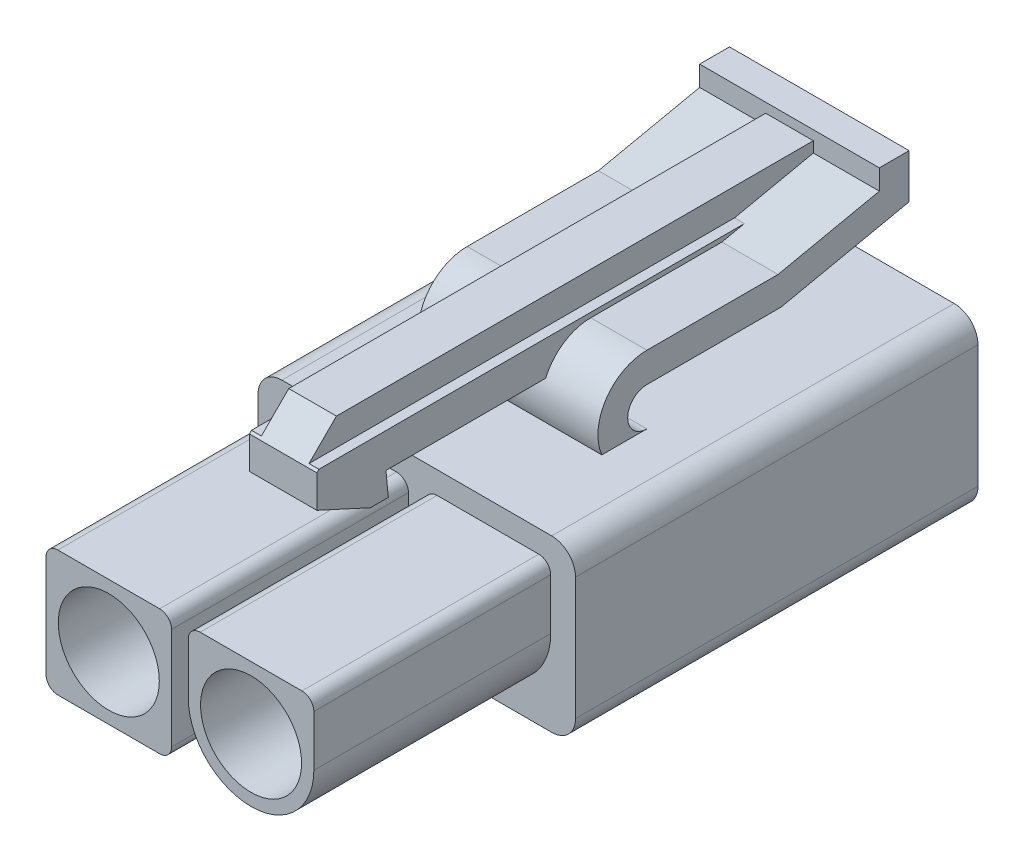
from build123d import *

# Parameters (mm, degrees)
SKETCH1_W               = 13.32
SKETCH1_H               = 7.14
BOSS_EXTRUDE1_DEPTH     = 16.89
SKETCH2_W               = 5.27
SKETCH2_H               = 5.27
BOSS_EXTRUDE2_DEPTH     = 9.94
CUT_EXTRUDE1_DEPTH      = 19.503313217
CUT_EXTRUDE1_DEPTH_BACK = 19.503313217
SKETCH3_R               = 2.12
BOSS_EXTRUDE3_DEPTH     = 3.77
BOSS_EXTRUDE4_DEPTH     = 1.415
CUT_EXTRUDE3_DEPTH      = 0.415
CUT_EXTRUDE4_DEPTH      = 0.415
FILLET1_R               = 1
FILLET2_R               = 0.5


with BuildPart() as part:
    # Sketch1 → Boss-Extrude1 (new body)
    with BuildSketch(Plane.XY):
        Rectangle(SKETCH1_W, SKETCH1_H)
    extrude(amount=-BOSS_EXTRUDE1_DEPTH)

    # Sketch2 → Boss-Extrude2 (add)
    with BuildSketch(Plane.XY):
        with BuildLine():
            Line((0.35, 2.635), (0.35, 0))
            ThreePointArc((0.35, 0), (2.985, -2.635), (5.62, 0))
            Line((5.62, 0), (5.62, 2.635))
            Line((5.62, 2.635), (0.35, 2.635))
        make_face()
        with Locations((-2.985, 0)):
            Rectangle(SKETCH2_W, SKETCH2_H)
    extrude(amount=BOSS_EXTRUDE2_DEPTH)

    # Sketch3 → Cut-Extrude1 (cut, two sides: drawn at the far end of the back side and taken through both)
    with BuildSketch(Plane.XY.offset(-CUT_EXTRUDE1_DEPTH_BACK)):
        with Locations((2.985, 0)):
            Circle(SKETCH3_R)
        with Locations((-2.985, 0)):
            Circle(SKETCH3_R)
    extrude(amount=CUT_EXTRUDE1_DEPTH + CUT_EXTRUDE1_DEPTH_BACK, mode=Mode.SUBTRACT)

    # Sketch4 → Boss-Extrude3 (add, symmetric)
    with BuildSketch(Plane(origin=(0, 0, 0), x_dir=(0, 0, -1), z_dir=(1, 0, 0))):
        with BuildLine():
            Line((5.885, 5.18), (11.5212493, 5.18))
            Line((11.5212493, 5.18), (16.89, 6.32))
            Line((16.89, 6.32), (16.89, 8.18))
            Line((16.89, 8.18), (15.64, 8.18))
            Line((15.64, 8.18), (15.64, 7.332444585))
            Line((15.64, 7.332444585), (11.39, 6.43))
            Line((11.39, 6.43), (5.885, 6.43))
            ThreePointArc((5.885, 6.43), (4.170750893, 5.508302696), (3.99423296, 3.57))
            Line((3.99423296, 3.57), (5.885, 3.57))
            ThreePointArc((5.885, 3.57), (5.08, 4.375), (5.885, 5.18))
        make_face()
    extrude(amount=BOSS_EXTRUDE3_DEPTH, both=True)

    # Sketch5 → Boss-Extrude4 (add, symmetric)
    with BuildSketch(Plane(origin=(0, 0, 0), x_dir=(0, 0, -1), z_dir=(1, 0, 0))):
        Polygon((15.64, 7.78), (-4.372563133, 7.78), (-5.61, 6.542563133), (-5.61, 5.18), (-3.36, 4.15), (-2.61, 4.15), (-2.71, 5.18), (5.503211952, 5.18), (15.64, 7.332444585), align=None)
    extrude(amount=BOSS_EXTRUDE4_DEPTH, both=True)

    # Sketch7 → Cut-Extrude3 (cut)
    with BuildSketch(Plane.ZY.offset(1.415)):
        Polygon((4.372563133, 7.78), (5.522563133, 6.63), (-12.331886088, 6.63), (-15.64, 7.332444585), (-15.64, 7.78), align=None)
    extrude(amount=-CUT_EXTRUDE3_DEPTH, mode=Mode.SUBTRACT)

    # Sketch8 → Cut-Extrude4 (cut)
    with BuildSketch(Plane(origin=(1.415, 0, 0), x_dir=(0, 0, -1), z_dir=(1, 0, 0))):
        Polygon((-4.372563133, 7.78), (-5.522563133, 6.63), (12.331886088, 6.63), (15.64, 7.332444585), (15.64, 7.78), align=None)
    extrude(amount=-CUT_EXTRUDE4_DEPTH, mode=Mode.SUBTRACT)

    # Fillet1
    fillet1_edges = [part.edges().sort_by_distance(p)[0] for p in [
        (-6.66, -3.57, -8.445),
        (6.66, -3.57, -8.445),
        (6.66, 3.57, -8.445),
        (-6.66, 3.57, -8.445),
    ]]
    fillet(fillet1_edges, radius=FILLET1_R)

    # Fillet2
    fillet2_edges = [part.edges().sort_by_distance(p)[0] for p in [
        (-5.62, -2.635, 4.97),
        (-0.35, -2.635, 4.97),
        (-0.35, 2.635, 4.97),
        (-5.62, 2.635, 4.97),
        (5.62, 2.635, 4.97),
        (0.35, 2.635, 4.97),
    ]]
    fillet(fillet2_edges, radius=FILLET2_R)


solid = part.part
